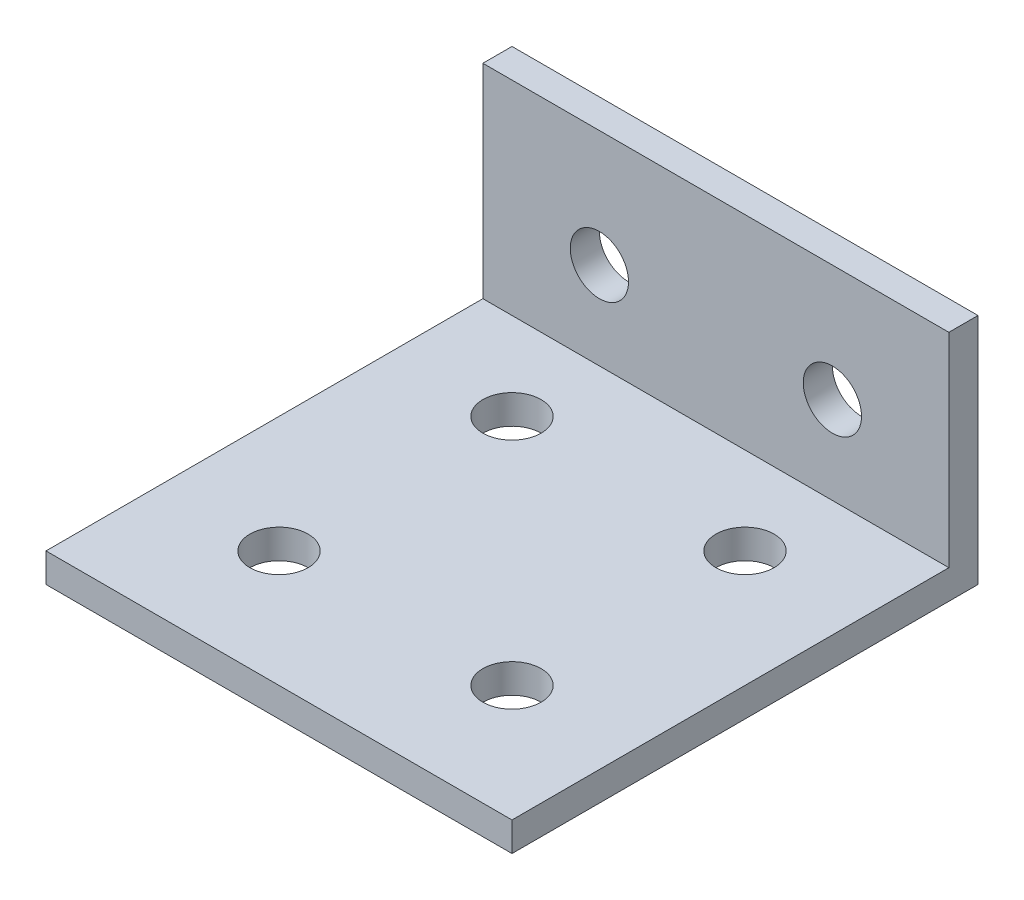
from build123d import *

# Parameters (mm, degrees)
SKETCH1_W           = 50.8
SKETCH1_H           = 50.8
SKETCH1_R           = 3.175
BOSS_EXTRUDE1_DEPTH = 3.175
SKETCH2_W           = 50.8
SKETCH2_H           = 3.175
BOSS_EXTRUDE2_DEPTH = 22.225
CUT_EXTRUDE1_REACH  = 61.653
SKETCH3_R           = 3.175


with BuildPart() as part:
    # Sketch1 → Boss-Extrude1 (new body)
    with BuildSketch(Plane(origin=(0, 0, 0), x_dir=(1, 0, 0), z_dir=(0, 1, 0))):
        Rectangle(SKETCH1_W, SKETCH1_H)
        with Locations(Location((-12.7, -12.7, 0), (0, 0, 270))):
            Circle(SKETCH1_R, mode=Mode.SUBTRACT)
        with Locations(Location((12.7, 12.7, 0), (0, 0, 90))):
            Circle(SKETCH1_R, mode=Mode.SUBTRACT)
        with Locations(Location((12.7, -12.7, 0), (0, 0, 270))):
            Circle(SKETCH1_R, mode=Mode.SUBTRACT)
        with Locations(Location((-12.7, 12.7, 0), (0, 0, 90))):
            Circle(SKETCH1_R, mode=Mode.SUBTRACT)
    extrude(amount=BOSS_EXTRUDE1_DEPTH)

    # Sketch2 → Boss-Extrude2 (add)
    with BuildSketch(Plane(origin=(0, 3.175, 0), x_dir=(1, 0, 0), z_dir=(0, 1, 0))):
        with Locations((0, 23.8125)):
            Rectangle(SKETCH2_W, SKETCH2_H)
    extrude(amount=BOSS_EXTRUDE2_DEPTH)

    # Sketch3 → Cut-Extrude1 (cut, up to next)
    with BuildSketch(Plane.XY.offset(-22.225), mode=Mode.PRIVATE) as cut_extrude1_sk1:
        with Locations((-12.7, 12.7)):
            Circle(SKETCH3_R)
    cut_extrude1_tool1 = extrude(cut_extrude1_sk1.sketch, amount=-CUT_EXTRUDE1_REACH, mode=Mode.PRIVATE) & part.part
    # Sketch3 → Cut-Extrude1 (cut, up to next)
    with BuildSketch(Plane.XY.offset(-22.225), mode=Mode.PRIVATE) as cut_extrude1_sk2:
        with Locations((12.7, 12.7)):
            Circle(SKETCH3_R)
    cut_extrude1_tool2 = extrude(cut_extrude1_sk2.sketch, amount=-CUT_EXTRUDE1_REACH, mode=Mode.PRIVATE) & part.part
    add(cut_extrude1_tool1.solids().sort_by_distance((-12.7, 12.7, -22.225))[0], mode=Mode.SUBTRACT)
    add(cut_extrude1_tool2.solids().sort_by_distance((12.7, 12.7, -22.225))[0], mode=Mode.SUBTRACT)


solid = part.part
